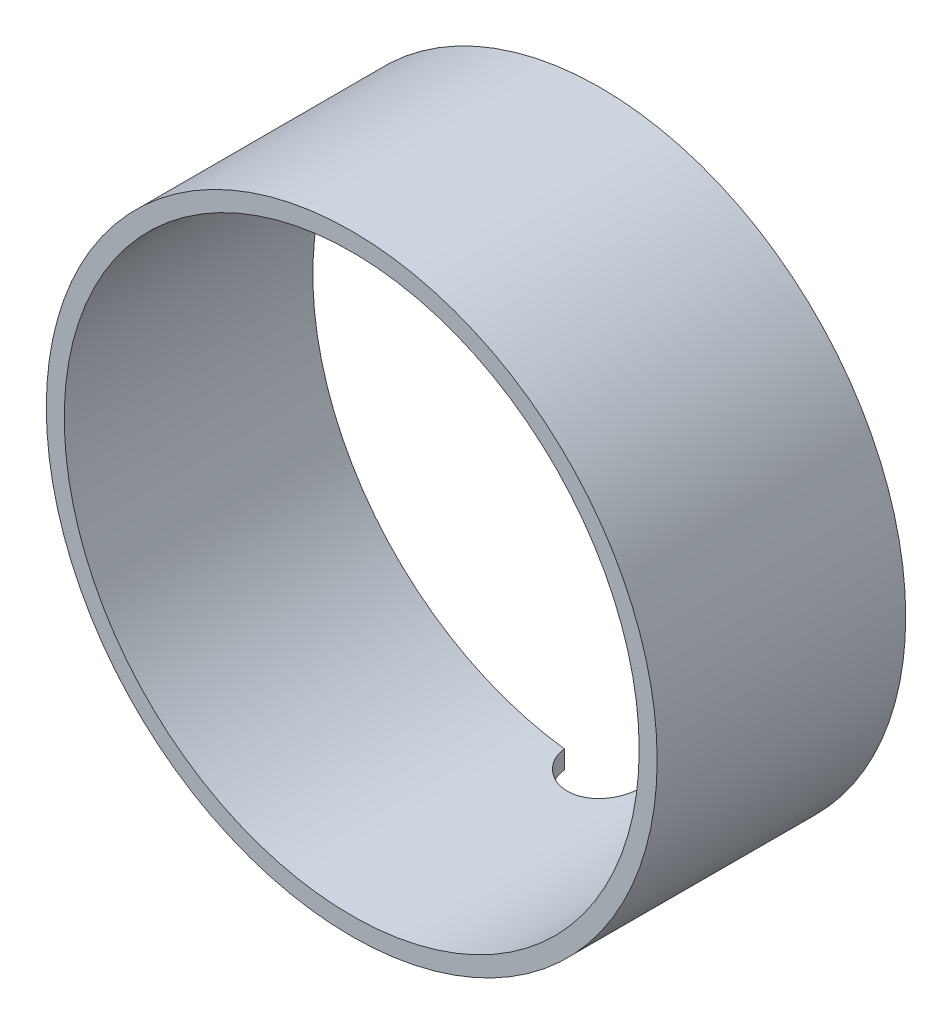
from build123d import *

# Parameters (mm, degrees)
SKETCH1_R          = 161.925
SKETCH1_R_2        = 152.4
BASE_EXTRUDE_DEPTH = 131.7625
SKETCH3_R          = 19.05
CUT_EXTRUDE1_DEPTH = 265.198349079


with BuildPart() as part:
    # Sketch1 → Base-Extrude (new body)
    with BuildSketch(Plane.XY):
        Circle(SKETCH1_R)
        Circle(SKETCH1_R_2, mode=Mode.SUBTRACT)
    extrude(amount=-BASE_EXTRUDE_DEPTH)

    # Sketch3 → Cut-Extrude1 (cut, through all)
    with BuildSketch(Plane(origin=(0, 0, 0), x_dir=(1, 0, 0), z_dir=(0, 1, 0))):
        with Locations((0, 133.35)):
            Circle(SKETCH3_R)
    extrude(amount=-CUT_EXTRUDE1_DEPTH, mode=Mode.SUBTRACT)


solid = part.part
